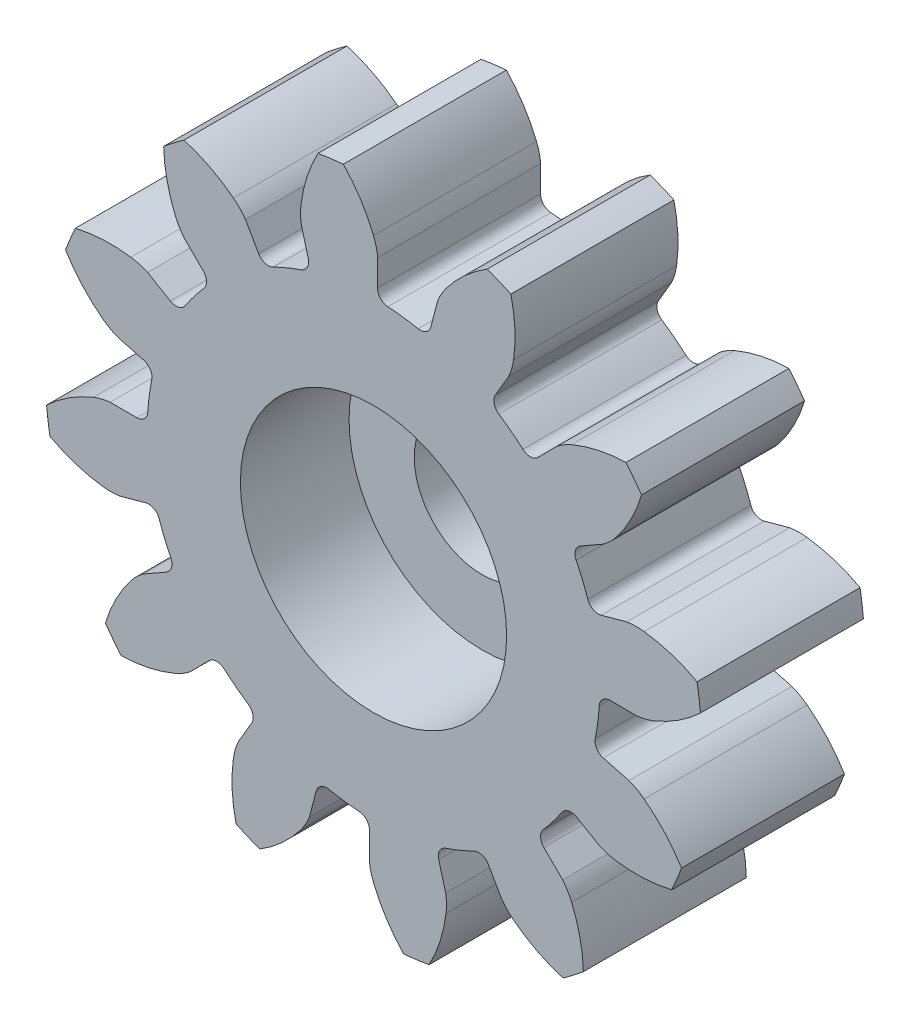
from build123d import *

# Parameters (mm, degrees)
BOSS_EXTRUDE1_DEPTH      = 2
BOSS_EXTRUDE1_DEPTH_BACK = 1
SKETCH1_R                = 2.45
SKETCH2_R                = 2.45
SKETCH2_R_2              = 1.25
BOSS_EXTRUDE2_DEPTH      = 1


with BuildPart() as part:
    # Sketch1 → Boss-Extrude1 (new, two sides: drawn at the far end of the back side and taken through both)
    with BuildSketch(Plane.XY.offset(-BOSS_EXTRUDE1_DEPTH_BACK)):
        with BuildLine():
            Line((-1.328942795, 4.660504482), (-1.19987949, 4.189818801))
            ThreePointArc((-1.19987949, 4.189818801), (-1.216390887, 4.041213658), (-1.330404162, 3.944481617))
            ThreePointArc((-1.330404162, 3.944481617), (-1.593034897, 3.845926453), (-1.848431895, 3.729907504))
            ThreePointArc((-1.848431895, 3.729907504), (-1.997451337, 3.717687826), (-2.114206362, 3.81109221))
            Line((-2.114206362, 3.81109221), (-2.35576986, 4.235178785))
            ThreePointArc((-2.35576986, 4.235178785), (-2.458763141, 4.358582017), (-2.578277712, 4.466063368))
            ThreePointArc((-2.578277712, 4.466063368), (-3.011522784, 4.742385054), (-3.488492609, 4.933578024))
            ThreePointArc((-3.488492609, 4.933578024), (-3.678338502, 4.793704066), (-3.862582103, 4.646529059))
            ThreePointArc((-3.862582103, 4.646529059), (-3.80135275, 4.136327205), (-3.646578574, 3.646327286))
            ThreePointArc((-3.646578574, 3.646327286), (-3.573692208, 3.503066854), (-3.481150462, 3.371643878))
            Line((-3.481150462, 3.371643878), (-3.13403552, 3.028549774))
            ThreePointArc((-3.13403552, 3.028549774), (-3.074032238, 2.891598246), (-3.12440461, 2.750819204))
            ThreePointArc((-3.12440461, 2.750819204), (-3.302571916, 2.534152561), (-3.46574273, 2.305978705))
            ThreePointArc((-3.46574273, 2.305978705), (-3.588687514, 2.220886432), (-3.736502523, 2.243399489))
            Line((-3.736502523, 2.243399489), (-4.157745937, 2.489887487))
            ThreePointArc((-4.157745937, 2.489887487), (-4.308642351, 2.545261181), (-4.465885681, 2.578585476))
            ThreePointArc((-4.465885681, 2.578585476), (-4.979247762, 2.601264539), (-5.487912233, 2.528357596))
            ThreePointArc((-5.487912233, 2.528357596), (-5.582386619, 2.312300248), (-5.668358756, 2.092721153))
            ThreePointArc((-5.668358756, 2.092721153), (-5.360231653, 1.681488063), (-4.981193325, 1.334522773))
            ThreePointArc((-4.981193325, 1.334522773), (-4.846441665, 1.246898783), (-4.700586673, 1.17935402))
            Line((-4.700586673, 1.17935402), (-4.228429264, 1.05578328))
            ThreePointArc((-4.228429264, 1.05578328), (-4.107989133, 0.96718142), (-4.081223366, 0.820077007))
            ThreePointArc((-4.081223366, 0.820077007), (-4.127187457, 0.543354537), (-4.1544106, 0.264164774))
            ThreePointArc((-4.1544106, 0.264164774), (-4.218337769, 0.129000312), (-4.357605851, 0.074589687))
            Line((-4.357605851, 0.074589687), (-4.845657348, 0.077432848))
            ThreePointArc((-4.845657348, 0.077432848), (-5.004024322, 0.049939666), (-5.156863188, 0.000177687))
            ThreePointArc((-5.156863188, 0.000177687), (-5.612787323, -0.236862708), (-6.016850205, -0.554334209))
            ThreePointArc((-6.016850205, -0.554334209), (-5.99063875, -0.788682554), (-5.955303257, -1.021829696))
            ThreePointArc((-5.955303257, -1.021829696), (-5.482840813, -1.223904448), (-4.981101347, -1.334866039))
            ThreePointArc((-4.981101347, -1.334866039), (-4.820590991, -1.34337481), (-4.660504482, -1.328942795))
            Line((-4.660504482, -1.328942795), (-4.189818801, -1.19987949))
            ThreePointArc((-4.189818801, -1.19987949), (-4.041213658, -1.216390887), (-3.944481617, -1.330404162))
            ThreePointArc((-3.944481617, -1.330404162), (-3.845926453, -1.593034897), (-3.729907504, -1.848431895))
            ThreePointArc((-3.729907504, -1.848431895), (-3.717687826, -1.997451337), (-3.81109221, -2.114206362))
            Line((-3.81109221, -2.114206362), (-4.235178785, -2.35576986))
            ThreePointArc((-4.235178785, -2.35576986), (-4.358582017, -2.458763141), (-4.466063368, -2.578277712))
            ThreePointArc((-4.466063368, -2.578277712), (-4.742385054, -3.011522784), (-4.933578024, -3.488492609))
            ThreePointArc((-4.933578024, -3.488492609), (-4.793704066, -3.678338502), (-4.646529059, -3.862582103))
            ThreePointArc((-4.646529059, -3.862582103), (-4.136327205, -3.80135275), (-3.646327286, -3.646578574))
            ThreePointArc((-3.646327286, -3.646578574), (-3.503066854, -3.573692208), (-3.371643878, -3.481150462))
            Line((-3.371643878, -3.481150462), (-3.028549774, -3.13403552))
            ThreePointArc((-3.028549774, -3.13403552), (-2.891598246, -3.074032238), (-2.750819204, -3.12440461))
            ThreePointArc((-2.750819204, -3.12440461), (-2.534152561, -3.302571916), (-2.305978705, -3.46574273))
            ThreePointArc((-2.305978705, -3.46574273), (-2.220886432, -3.588687514), (-2.243399489, -3.736502523))
            Line((-2.243399489, -3.736502523), (-2.489887487, -4.157745937))
            ThreePointArc((-2.489887487, -4.157745937), (-2.545261181, -4.308642351), (-2.578585476, -4.465885681))
            ThreePointArc((-2.578585476, -4.465885681), (-2.601264539, -4.979247762), (-2.528357596, -5.487912233))
            ThreePointArc((-2.528357596, -5.487912233), (-2.312300248, -5.582386619), (-2.092721153, -5.668358756))
            ThreePointArc((-2.092721153, -5.668358756), (-1.681488063, -5.360231653), (-1.334522773, -4.981193325))
            ThreePointArc((-1.334522773, -4.981193325), (-1.246898783, -4.846441665), (-1.17935402, -4.700586673))
            Line((-1.17935402, -4.700586673), (-1.05578328, -4.228429264))
            ThreePointArc((-1.05578328, -4.228429264), (-0.96718142, -4.107989133), (-0.820077007, -4.081223366))
            ThreePointArc((-0.820077007, -4.081223366), (-0.543354537, -4.127187457), (-0.264164774, -4.1544106))
            ThreePointArc((-0.264164774, -4.1544106), (-0.129000312, -4.218337769), (-0.074589687, -4.357605851))
            Line((-0.074589687, -4.357605851), (-0.077432848, -4.845657348))
            ThreePointArc((-0.077432848, -4.845657348), (-0.049939666, -5.004024322), (-0.000177687, -5.156863188))
            ThreePointArc((-0.000177687, -5.156863188), (0.236862708, -5.612787323), (0.554334209, -6.016850205))
            ThreePointArc((0.554334209, -6.016850205), (0.788682554, -5.99063875), (1.021829696, -5.955303257))
            ThreePointArc((1.021829696, -5.955303257), (1.223904448, -5.482840813), (1.334866039, -4.981101347))
            ThreePointArc((1.334866039, -4.981101347), (1.34337481, -4.820590991), (1.328942795, -4.660504482))
            Line((1.328942795, -4.660504482), (1.19987949, -4.189818801))
            ThreePointArc((1.19987949, -4.189818801), (1.216390887, -4.041213658), (1.330404162, -3.944481617))
            ThreePointArc((1.330404162, -3.944481617), (1.593034897, -3.845926453), (1.848431895, -3.729907504))
            ThreePointArc((1.848431895, -3.729907504), (1.997451337, -3.717687826), (2.114206362, -3.81109221))
            Line((2.114206362, -3.81109221), (2.35576986, -4.235178785))
            ThreePointArc((2.35576986, -4.235178785), (2.458763141, -4.358582017), (2.578277712, -4.466063368))
            ThreePointArc((2.578277712, -4.466063368), (3.011522784, -4.742385054), (3.488492609, -4.933578024))
            ThreePointArc((3.488492609, -4.933578024), (3.678338502, -4.793704066), (3.862582103, -4.646529059))
            ThreePointArc((3.862582103, -4.646529059), (3.80135275, -4.136327205), (3.646578574, -3.646327286))
            ThreePointArc((3.646578574, -3.646327286), (3.573692208, -3.503066854), (3.481150462, -3.371643878))
            Line((3.481150462, -3.371643878), (3.13403552, -3.028549774))
            ThreePointArc((3.13403552, -3.028549774), (3.074032238, -2.891598246), (3.12440461, -2.750819204))
            ThreePointArc((3.12440461, -2.750819204), (3.302571916, -2.534152561), (3.46574273, -2.305978705))
            ThreePointArc((3.46574273, -2.305978705), (3.588687514, -2.220886432), (3.736502523, -2.243399489))
            Line((3.736502523, -2.243399489), (4.157745937, -2.489887487))
            ThreePointArc((4.157745937, -2.489887487), (4.308642351, -2.545261181), (4.465885681, -2.578585476))
            ThreePointArc((4.465885681, -2.578585476), (4.979247762, -2.601264539), (5.487912233, -2.528357596))
            ThreePointArc((5.487912233, -2.528357596), (5.582386619, -2.312300248), (5.668358756, -2.092721153))
            ThreePointArc((5.668358756, -2.092721153), (5.360231653, -1.681488063), (4.981193325, -1.334522773))
            ThreePointArc((4.981193325, -1.334522773), (4.846441665, -1.246898783), (4.700586673, -1.17935402))
            Line((4.700586673, -1.17935402), (4.228429264, -1.05578328))
            ThreePointArc((4.228429264, -1.05578328), (4.107989133, -0.96718142), (4.081223366, -0.820077007))
            ThreePointArc((4.081223366, -0.820077007), (4.127187457, -0.543354537), (4.1544106, -0.264164774))
            ThreePointArc((4.1544106, -0.264164774), (4.218337769, -0.129000312), (4.357605851, -0.074589687))
            Line((4.357605851, -0.074589687), (4.845657348, -0.077432848))
            ThreePointArc((4.845657348, -0.077432848), (5.004024322, -0.049939666), (5.156863188, -0.000177687))
            ThreePointArc((5.156863188, -0.000177687), (5.612787323, 0.236862708), (6.016850205, 0.554334209))
            ThreePointArc((6.016850205, 0.554334209), (5.99063875, 0.788682554), (5.955303257, 1.021829696))
            ThreePointArc((5.955303257, 1.021829696), (5.482840813, 1.223904448), (4.981101347, 1.334866039))
            ThreePointArc((4.981101347, 1.334866039), (4.820590991, 1.34337481), (4.660504482, 1.328942795))
            Line((4.660504482, 1.328942795), (4.189818801, 1.19987949))
            ThreePointArc((4.189818801, 1.19987949), (4.041213658, 1.216390887), (3.944481617, 1.330404162))
            ThreePointArc((3.944481617, 1.330404162), (3.845926453, 1.593034897), (3.729907504, 1.848431895))
            ThreePointArc((3.729907504, 1.848431895), (3.717687826, 1.997451337), (3.81109221, 2.114206362))
            Line((3.81109221, 2.114206362), (4.235178785, 2.35576986))
            ThreePointArc((4.235178785, 2.35576986), (4.358582017, 2.458763141), (4.466063368, 2.578277712))
            ThreePointArc((4.466063368, 2.578277712), (4.742385054, 3.011522784), (4.933578024, 3.488492609))
            ThreePointArc((4.933578024, 3.488492609), (4.793704066, 3.678338502), (4.646529059, 3.862582103))
            ThreePointArc((4.646529059, 3.862582103), (4.136327205, 3.80135275), (3.646327286, 3.646578574))
            ThreePointArc((3.646327286, 3.646578574), (3.503066854, 3.573692208), (3.371643878, 3.481150462))
            Line((3.371643878, 3.481150462), (3.028549774, 3.13403552))
            ThreePointArc((3.028549774, 3.13403552), (2.891598246, 3.074032238), (2.750819204, 3.12440461))
            ThreePointArc((2.750819204, 3.12440461), (2.534152561, 3.302571916), (2.305978705, 3.46574273))
            ThreePointArc((2.305978705, 3.46574273), (2.220886432, 3.588687514), (2.243399489, 3.736502523))
            Line((2.243399489, 3.736502523), (2.489887487, 4.157745937))
            ThreePointArc((2.489887487, 4.157745937), (2.545261181, 4.308642351), (2.578585476, 4.465885681))
            ThreePointArc((2.578585476, 4.465885681), (2.601264539, 4.979247762), (2.528357596, 5.487912233))
            ThreePointArc((2.528357596, 5.487912233), (2.312300248, 5.582386619), (2.092721153, 5.668358756))
            ThreePointArc((2.092721153, 5.668358756), (1.681488063, 5.360231653), (1.334522773, 4.981193325))
            ThreePointArc((1.334522773, 4.981193325), (1.246898783, 4.846441665), (1.17935402, 4.700586673))
            Line((1.17935402, 4.700586673), (1.05578328, 4.228429264))
            ThreePointArc((1.05578328, 4.228429264), (0.96718142, 4.107989133), (0.820077007, 4.081223366))
            ThreePointArc((0.820077007, 4.081223366), (0.543354537, 4.127187457), (0.264164774, 4.1544106))
            ThreePointArc((0.264164774, 4.1544106), (0.129000312, 4.218337769), (0.074589687, 4.357605851))
            Line((0.074589687, 4.357605851), (0.077432848, 4.845657348))
            ThreePointArc((0.077432848, 4.845657348), (0.049939666, 5.004024322), (0.000177687, 5.156863188))
            ThreePointArc((0.000177687, 5.156863188), (-0.236862708, 5.612787323), (-0.554334209, 6.016850205))
            ThreePointArc((-0.554334209, 6.016850205), (-0.788682554, 5.99063875), (-1.021829696, 5.955303257))
            ThreePointArc((-1.021829696, 5.955303257), (-1.223904448, 5.482840813), (-1.334866039, 4.981101347))
            ThreePointArc((-1.334866039, 4.981101347), (-1.34337481, 4.820590991), (-1.328942795, 4.660504482))
        make_face()
        Circle(SKETCH1_R, mode=Mode.SUBTRACT)
    extrude(amount=BOSS_EXTRUDE1_DEPTH + BOSS_EXTRUDE1_DEPTH_BACK)

    # Sketch2 → Boss-Extrude2 (add)
    with BuildSketch(Plane(origin=(0, 0, -1), x_dir=(-1, 0, 0), z_dir=(0, 0, -1))):
        with Locations(Location((0, 0, 0), (0, 0, 180))):
            Circle(SKETCH2_R)
        Circle(SKETCH2_R_2, mode=Mode.SUBTRACT)
    extrude(amount=-BOSS_EXTRUDE2_DEPTH)


solid = part.part
